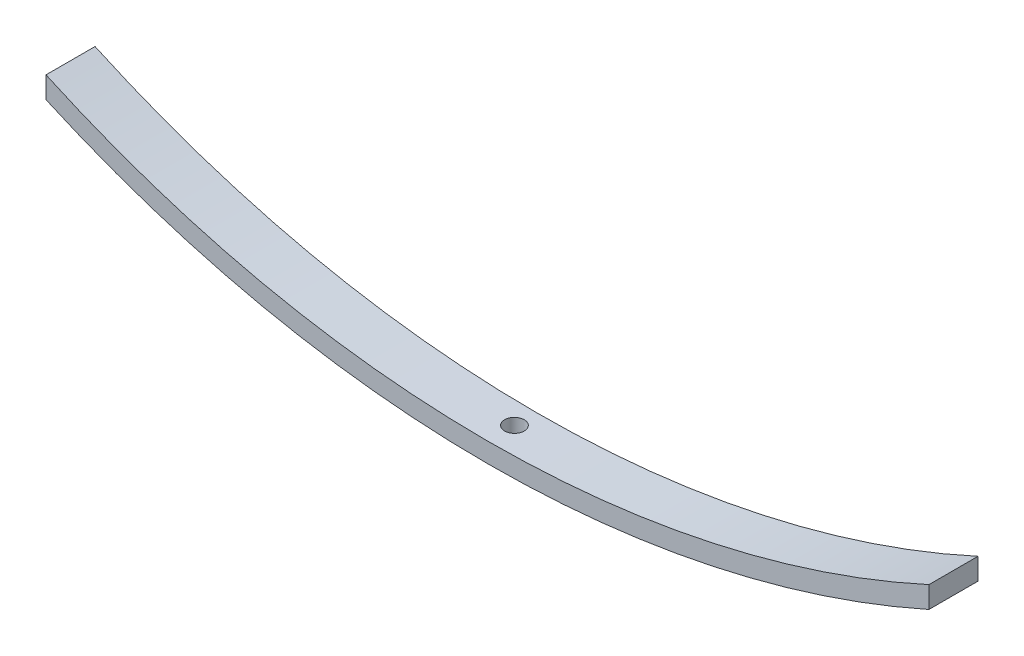
from build123d import *

# Parameters (mm, degrees)
BOSS_EXTRUDE1_DEPTH = 50
SKETCH3_R           = 10
CUT_EXTRUDE1_DEPTH  = 1190.537725337


with BuildPart() as part:
    # Sketch1 → Boss-Extrude1 (new body)
    with BuildSketch(Plane.XY):
        with BuildLine():
            Line((-450, -1003.742994994), (-450, -981.784090317))
            ThreePointArc((-450, -981.784090317), (0, -1080), (450, -981.784090317))
            Line((450, -981.784090317), (450, -1003.742994994))
            ThreePointArc((450, -1003.742994994), (0, -1100), (-450, -1003.742994994))
        make_face()
    extrude(amount=BOSS_EXTRUDE1_DEPTH)

    # Sketch3 → Cut-Extrude1 (cut, through all)
    with BuildSketch(Plane(origin=(0, 0, 0), x_dir=(1, 0, 0), z_dir=(0, 1, 0))):
        with Locations(Location((0, -22.5, 0), (0, 0, 270))):
            Circle(SKETCH3_R)
    extrude(amount=-CUT_EXTRUDE1_DEPTH, mode=Mode.SUBTRACT)


solid = part.part
